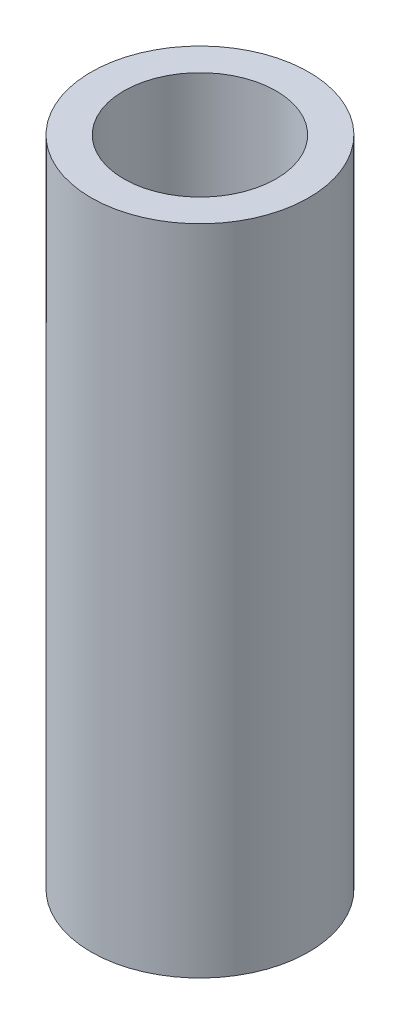
from build123d import *

# Parameters (mm, degrees)
SKETCH1_R           = 2.5
SKETCH1_R_2         = 1.75
BOSS_EXTRUDE1_DEPTH = 15


with BuildPart() as part:
    # Sketch1 → Boss-Extrude1 (new body)
    with BuildSketch(Plane(origin=(0, 0, 0), x_dir=(1, 0, 0), z_dir=(0, 1, 0))):
        with Locations(Location((0, 0, 0), (0, 0, 270))):
            Circle(SKETCH1_R)
        with Locations(Location((0, 0, 0), (0, 0, 270))):
            Circle(SKETCH1_R_2, mode=Mode.SUBTRACT)
    extrude(amount=BOSS_EXTRUDE1_DEPTH)


solid = part.part
